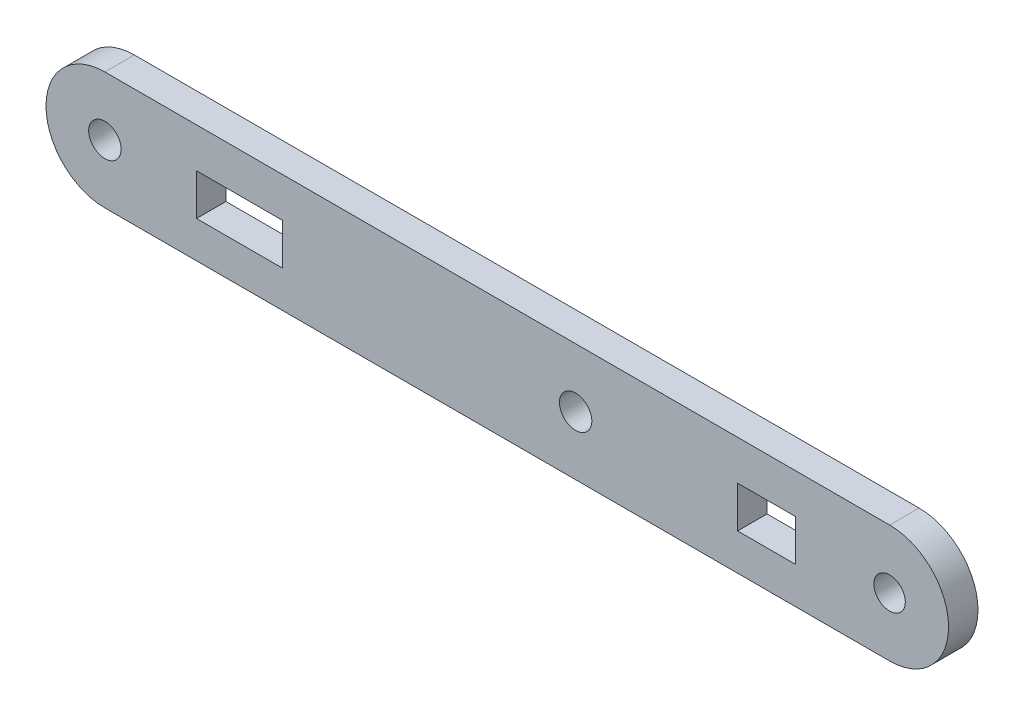
from build123d import *

# Parameters (mm, degrees)
SKETCH_1_R          = 1.65
SKETCH_1_R_2        = 1.3
SKETCH_1_R_3        = 1.6
SKETCH_1_W          = 8.751182885
SKETCH_1_H          = 4.216885397
SKETCH_1_W_2        = 5.900028074
EXTRUDE_1_DEPTH     = 3
SKETCH_2_R          = 1.65
CUT_EXTRUDE_1_DEPTH = 57.708942736
CUT_EXTRUDE_3_DEPTH = 1


with BuildPart() as part:
    # 草图1 → 凸台-拉伸1 (new body)
    with BuildSketch(Plane(origin=(0, 0, 0), x_dir=(-1, 0, 0), z_dir=(0, 0, -1))):
        with BuildLine():
            Line((-30.618171933, 0), (49.343510787, 0))
            ThreePointArc((49.343510787, 0), (55.343510787, 6), (49.343510787, 12))
            Line((49.343510787, 12), (-30.618171933, 12))
            ThreePointArc((-30.618171933, 12), (-36.618171933, 6), (-30.618171933, 0))
        make_face()
        with Locations(Location((49.343510787, 6, 0), (0, 0, 180))):
            Circle(SKETCH_1_R, mode=Mode.SUBTRACT)
        with Locations(Location((1.379286828, 6.00015, 0), (0, 0, 180))):
            Circle(SKETCH_1_R_2, mode=Mode.SUBTRACT)
        with Locations(Location((-30.611606698, 6.0001, 0), (0, 0, 180))):
            Circle(SKETCH_1_R_3, mode=Mode.SUBTRACT)
        with Locations((35.633887137, 5.842992625)):
            Rectangle(SKETCH_1_W, SKETCH_1_H, mode=Mode.SUBTRACT)
        with Locations((-18.07705416, 5.842992625)):
            Rectangle(SKETCH_1_W_2, SKETCH_1_H, mode=Mode.SUBTRACT)
    extrude(amount=-EXTRUDE_1_DEPTH)

    # 草图2 → 切除-拉伸1 (cut, through all)
    with BuildSketch(Plane.XY.offset(3)):
        with Locations((-49.343510787, 6)):
            Circle(SKETCH_2_R)
        with Locations((-1.379286828, 6.00015)):
            Circle(SKETCH_2_R)
    extrude(amount=-CUT_EXTRUDE_1_DEPTH, mode=Mode.SUBTRACT)

    # 草图4 → 切除-拉伸3 (cut)
    with BuildSketch(Plane(origin=(0, 0, 0), x_dir=(-1, 0, 0), z_dir=(0, 0, -1))):
        with BuildLine():
            Line((14.3516244, 6.660828267), (14.037521836, 6.660828267))
            add(Edge.make_bspline(
                [(14.037521836, 6.660828267), (14.039568989, 6.702499155), (14.043589543, 6.78433967), (14.062417832, 6.903663576), (14.089358709, 7.017718375), (14.127450163, 7.125588289), (14.174756441, 7.228227096), (14.231486468, 7.325227112), (14.298680319, 7.4162183), (14.374887053, 7.500357144), (14.457655692, 7.577544715), (14.546961631, 7.644199957), (14.640806659, 7.700517629), (14.738906058, 7.747598871), (14.842366621, 7.782938716), (14.950249479, 7.809160356), (15.063028615, 7.824936702), (15.139868637, 7.826632487), (15.178948118, 7.827494934)],
                knots=[0, 0, 0, 0, 1.10065271, 2.161652631, 3.183658789, 4.190468796, 5.17591951, 6.163126047, 7.15150782, 8.156236427, 9.156009102, 10.134482811, 11.092018607, 12.041330605, 13.001268258, 13.972401359, 14.968799086, 16, 16, 16, 16], degree=3))
            add(Edge.make_bspline(
                [(15.178948118, 7.827494934), (15.217326192, 7.826596478), (15.292737736, 7.824831043), (15.402799751, 7.809670014), (15.507577045, 7.785924422), (15.606864812, 7.752609006), (15.699870876, 7.707824578), (15.787293921, 7.65402704), (15.870174732, 7.591807208), (15.944781515, 7.518553395), (16.013289595, 7.44035101), (16.07239185, 7.356863107), (16.123005013, 7.270633821), (16.165192693, 7.181005619), (16.196248832, 7.087134591), (16.21982704, 6.990387388), (16.233154454, 6.889762577), (16.235199877, 6.821656021), (16.236239784, 6.78703019)],
                knots=[0, 0, 0, 0, 1.111607364, 2.184268762, 3.212621178, 4.221274766, 5.211760367, 6.196651075, 7.1921475, 8.207485113, 9.220403448, 10.201281604, 11.166441695, 12.114753415, 13.065576456, 14.026450734, 14.996634279, 16, 16, 16, 16], degree=3))
            add(Edge.make_bspline(
                [(16.236239784, 6.78703019), (16.234546521, 6.738282356), (16.23118971, 6.641642142), (16.202475333, 6.499627279), (16.157628822, 6.36203386), (16.103631466, 6.251296558), (16.049159021, 6.162063065), (16.000071514, 6.08859436), (15.942606703, 6.009488891), (15.875928205, 5.925011554), (15.801415333, 5.834500649), (15.718393169, 5.738010853), (15.626269687, 5.636539084), (15.561611187, 5.567233482), (15.528106771, 5.531321056)],
                knots=[0, 0, 0, 0, 1.184426356, 2.348067706, 3.509069118, 4.696110526, 5.333549288, 6.050745305, 6.844228056, 7.710549037, 8.667450064, 9.695053472, 10.805634456, 12, 12, 12, 12], degree=3))
            Line((15.528106771, 5.531321056), (14.65240565, 4.596725703))
            Line((14.65240565, 4.596725703), (16.281111579, 4.596725703))
            Line((16.281111579, 4.596725703), (16.281111579, 4.237751344))
            Line((16.281111579, 4.237751344), (13.902906451, 4.237751344))
            Line((13.902906451, 4.237751344), (15.260278246, 5.686268973))
            add(Edge.make_bspline(
                [(15.260278246, 5.686268973), (15.293326133, 5.720767279), (15.35680436, 5.787031466), (15.446586937, 5.883774426), (15.527225925, 5.973523967), (15.599243318, 6.056110515), (15.661076823, 6.132742083), (15.715949055, 6.200936786), (15.759914646, 6.263691237), (15.807630042, 6.336431851), (15.853844023, 6.425244168), (15.893556379, 6.533777857), (15.917771227, 6.64550511), (15.920676063, 6.721007147), (15.92213722, 6.758985319)],
                knots=[0, 0, 0, 0, 1.329631726, 2.553950428, 3.673215718, 4.687767853, 5.603093632, 6.413772471, 7.123043292, 7.734684054, 8.834405432, 9.900288307, 10.943827018, 12, 12, 12, 12], degree=3))
            add(Edge.make_bspline(
                [(15.92213722, 6.758985319), (15.921501478, 6.782866717), (15.920248552, 6.829932367), (15.909190854, 6.898938126), (15.892480348, 6.96550294), (15.86853509, 7.029831559), (15.83692835, 7.091277211), (15.79845497, 7.149914692), (15.754064907, 7.206603657), (15.702713637, 7.259756955), (15.646302118, 7.30843816), (15.586707868, 7.351562246), (15.523657764, 7.387601357), (15.457417642, 7.417144854), (15.388172172, 7.440320235), (15.315787427, 7.456378814), (15.240463411, 7.466461298), (15.189029915, 7.46782547), (15.162822316, 7.468520575)],
                knots=[0, 0, 0, 0, 0.991446411, 1.95395049, 2.89581595, 3.838931463, 4.798493298, 5.75982156, 6.748411868, 7.785213223, 8.824556874, 9.840280684, 10.836137867, 11.835679398, 12.848801643, 13.863922112, 14.911575587, 16, 16, 16, 16], degree=3))
            add(Edge.make_bspline(
                [(15.162822316, 7.468520575), (15.135451484, 7.467805543), (15.081699687, 7.466401338), (15.002780654, 7.456578674), (14.927494877, 7.439632833), (14.855652974, 7.416456159), (14.787133388, 7.38699761), (14.722269344, 7.350305865), (14.661206455, 7.306522372), (14.603829931, 7.256881816), (14.550965952, 7.201614215), (14.504519077, 7.140004251), (14.463935062, 7.073176836), (14.428525829, 7.001312286), (14.399770139, 6.923758506), (14.377796988, 6.840790801), (14.360410142, 6.752769419), (14.354601621, 6.691984334), (14.3516244, 6.660828267)],
                knots=[0, 0, 0, 0, 1.031018746, 2.02475058, 2.990194455, 3.934040569, 4.864654155, 5.795059489, 6.735614925, 7.690564532, 8.649604399, 9.611025574, 10.590972636, 11.591080095, 12.624614302, 13.701020113, 14.821632451, 16, 16, 16, 16], degree=3))
        make_face()
    extrude(amount=-CUT_EXTRUDE_3_DEPTH, mode=Mode.SUBTRACT)


solid = part.part
